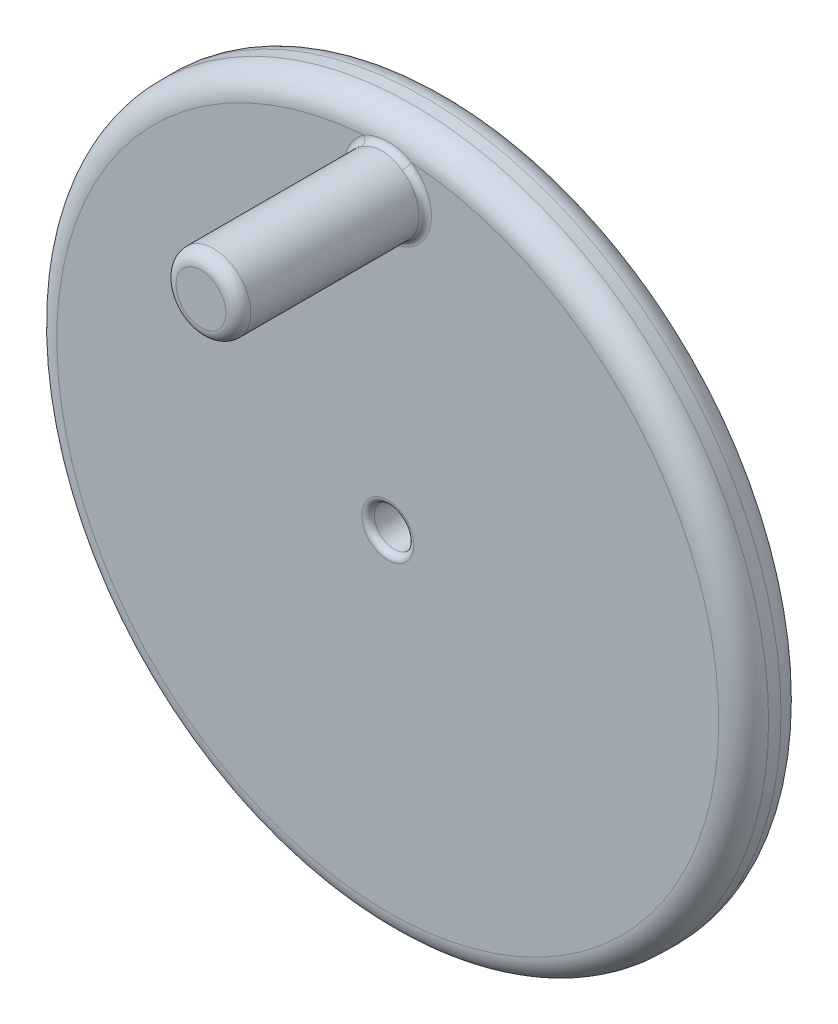
from build123d import *

# Parameters (mm, degrees)
SKETCH1_R           = 57.15
SKETCH1_R_2         = 3.175
BOSS_EXTRUDE1_DEPTH = 5
FILLET1_R           = 4
SKETCH2_R           = 6
BOSS_EXTRUDE2_DEPTH = 30
FILLET2_R           = 2
FILLET3_R           = 1


with BuildPart() as part:
    # Sketch1 → Boss-Extrude1 (new, symmetric)
    with BuildSketch(Plane.XY):
        Circle(SKETCH1_R)
        Circle(SKETCH1_R_2, mode=Mode.SUBTRACT)
    extrude(amount=BOSS_EXTRUDE1_DEPTH, both=True)

    # Fillet1
    fillet1_edges = [part.edges().sort_by_distance(p)[0] for p in [
        (-57.15, 0, -5),
        (-57.15, 0, 5),
    ]]
    fillet(fillet1_edges, radius=FILLET1_R)

    # Sketch2 → Boss-Extrude2 (add)
    with BuildSketch(Plane.XY.offset(5)):
        with Locations(Location((0, 47.15, 0), (0, 0, 90))):
            Circle(SKETCH2_R)
    extrude(amount=BOSS_EXTRUDE2_DEPTH)

    # Fillet2
    fillet2_edges = [part.edges().sort_by_distance(p)[0] for p in [
        (0, 41.15, 35),
    ]]
    fillet(fillet2_edges, radius=FILLET2_R)

    # Fillet3
    fillet3_edges = [part.edges().sort_by_distance(p)[0] for p in [
        (0, 41.15, 5),
        (-3.175, 0, -5),
        (-3.175, 0, 5),
    ]]
    fillet(fillet3_edges, radius=FILLET3_R)


solid = part.part
